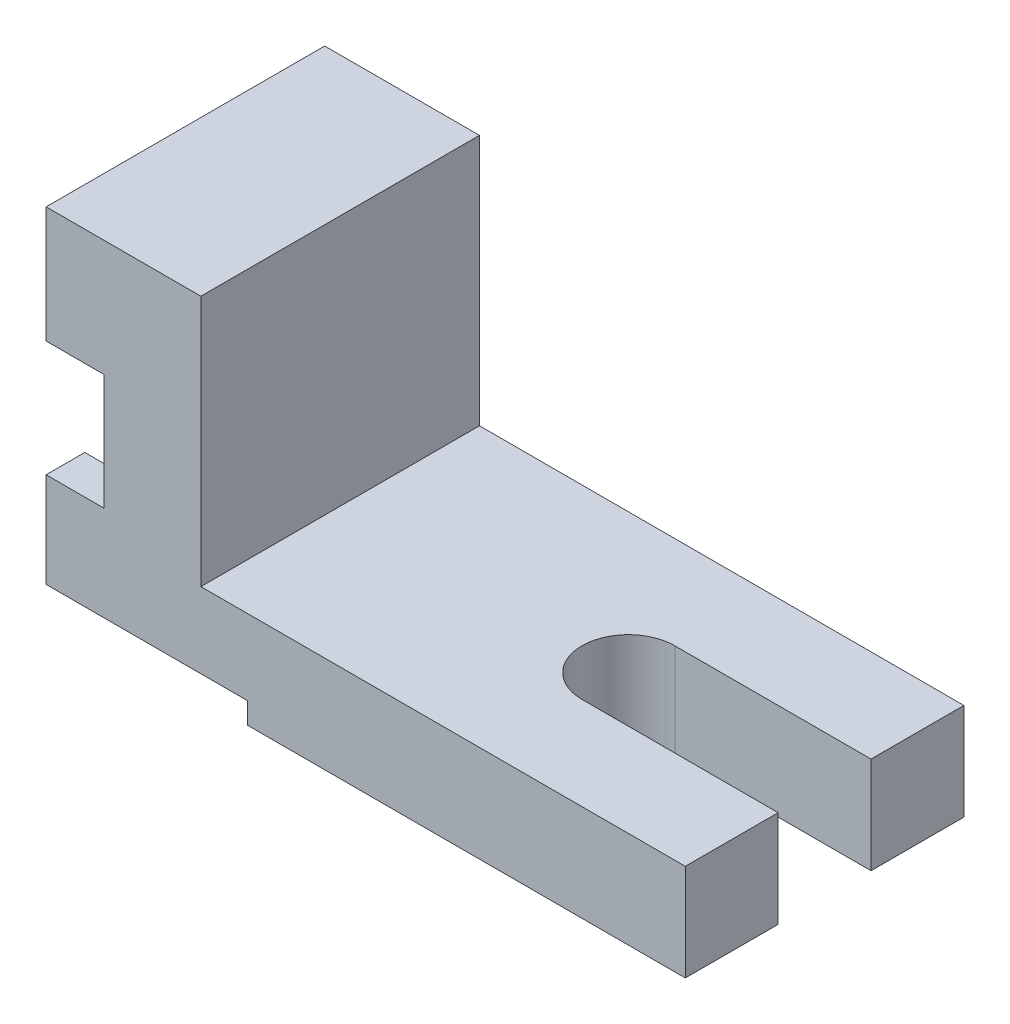
from build123d import *

# Parameters (mm, degrees)
BOSS_EXTRUDE1_DEPTH = 25
SKETCH3_W           = 72
SKETCH3_H           = 90
BOSS_EXTRUDE2_DEPTH = 25
SKETCH4_W           = 37.059895825
SKETCH4_H           = 5.488186397
CUT_EXTRUDE1_DEPTH  = 50
BOSS_EXTRUDE3_DEPTH = 15


with BuildPart() as part:
    # Sketch2 → Boss-Extrude1 (new body)
    with BuildSketch(Plane(origin=(0, 0, 0), x_dir=(1, 0, 0), z_dir=(0, 1, 0))):
        with BuildLine():
            Line((0, 0), (62.597938144, 0))
            Line((62.597938144, 0), (125.195876289, 0))
            Line((125.195876289, 0), (125.195876289, 24))
            Line((125.195876289, 24), (74.474226804, 24))
            ThreePointArc((74.474226804, 24), (62.474226804, 36), (74.474226804, 48))
            Line((74.474226804, 48), (125.195876289, 48))
            Line((125.195876289, 48), (125.195876289, 72))
            Line((125.195876289, 72), (0, 72))
            Line((0, 72), (0, 0))
        make_face()
    extrude(amount=BOSS_EXTRUDE1_DEPTH)

    # Sketch3 → Boss-Extrude2 (add)
    with BuildSketch(Plane.ZY):
        with Locations((-36, 45)):
            Rectangle(SKETCH3_W, SKETCH3_H)
    extrude(amount=BOSS_EXTRUDE2_DEPTH)

    # Sketch4 → Cut-Extrude1 (cut)
    with BuildSketch(Plane.XY):
        with Locations((-6.470052088, 2.744093199)):
            Rectangle(SKETCH4_W, SKETCH4_H)
    extrude(amount=-CUT_EXTRUDE1_DEPTH, mode=Mode.SUBTRACT)

    # Sketch5 → Boss-Extrude3 (add)
    with BuildSketch(Plane.ZY.offset(25)):
        with BuildLine():
            Line((0, 5.488186397), (-50, 5.488186397))
            Line((-50, 5.488186397), (-50, 0))
            Line((-50, 0), (-72, 0))
            Line((-72, 0), (-72, 30.033370453))
            Line((-72, 30.033370453), (-62, 30.033370453))
            ThreePointArc((-62, 30.033370453), (-36, 15), (-10, 30.033370453))
            Line((-10, 30.033370453), (0, 30.033370453))
            Line((0, 30.033370453), (0, 5.488186397))
        make_face()
        with BuildLine():
            Line((-50, 90), (0, 90))
            Line((0, 90), (0, 84.511813603))
            Line((0, 84.511813603), (0, 59.966629547))
            Line((0, 59.966629547), (-10, 59.966629547))
            ThreePointArc((-10, 59.966629547), (-36, 75), (-62, 59.966629547))
            Line((-62, 59.966629547), (-72, 59.966629547))
            Line((-72, 59.966629547), (-72, 90))
            Line((-72, 90), (-50, 90))
        make_face()
    extrude(amount=BOSS_EXTRUDE3_DEPTH)


solid = part.part
